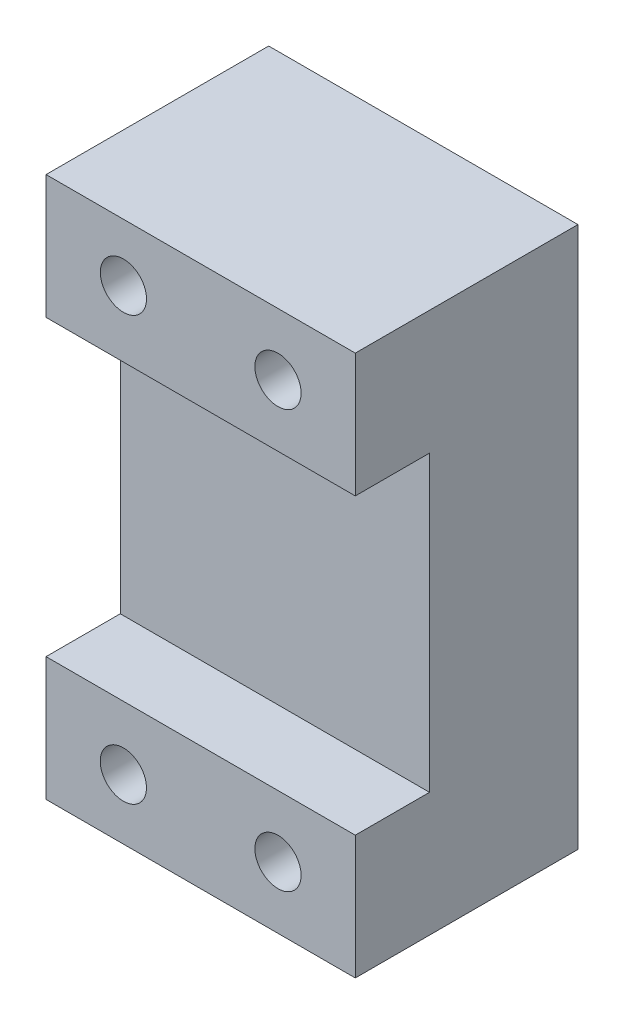
from build123d import *

# Parameters (mm, degrees)
SKETCH1_W                                           = 25.4
SKETCH1_H                                           = 44.45
BOSS_EXTRUDE2_DEPTH                                 = 18.288
SKETCH3_W                                           = 25.4
SKETCH3_H                                           = 24.13
CUT_EXTRUDE1_DEPTH                                  = 6.096
CBORE_FOR_6_BINDING_HEAD_MACHINE_SCREW1_D           = 3.7973
CBORE_FOR_6_BINDING_HEAD_MACHINE_SCREW1_CBORE_D     = 7.9375
CBORE_FOR_6_BINDING_HEAD_MACHINE_SCREW1_CBORE_DEPTH = 2.2098


with BuildPart() as part:
    # Sketch1 → Boss-Extrude2 (new body)
    with BuildSketch(Plane.XY):
        with Locations((12.7, 22.225)):
            Rectangle(SKETCH1_W, SKETCH1_H)
    extrude(amount=BOSS_EXTRUDE2_DEPTH)

    # Sketch3 → Cut-Extrude1 (cut)
    with BuildSketch(Plane.XY.offset(18.288)):
        with Locations((12.7, 22.225)):
            Rectangle(SKETCH3_W, SKETCH3_H)
    extrude(amount=-CUT_EXTRUDE1_DEPTH, mode=Mode.SUBTRACT)

    # CBORE for #6 Binding Head Machine Screw1 (through all)
    with Locations(Plane(origin=(19.05, 5.08, 0), x_dir=(-1, 0, 0), z_dir=(0, 0, -1))):
        with Locations((0, 0), (12.699317265, -0.131685219), (0, 34.29), (12.694984111, 34.646901144)):
            CounterBoreHole(CBORE_FOR_6_BINDING_HEAD_MACHINE_SCREW1_D / 2, CBORE_FOR_6_BINDING_HEAD_MACHINE_SCREW1_CBORE_D / 2, CBORE_FOR_6_BINDING_HEAD_MACHINE_SCREW1_CBORE_DEPTH)


solid = part.part
